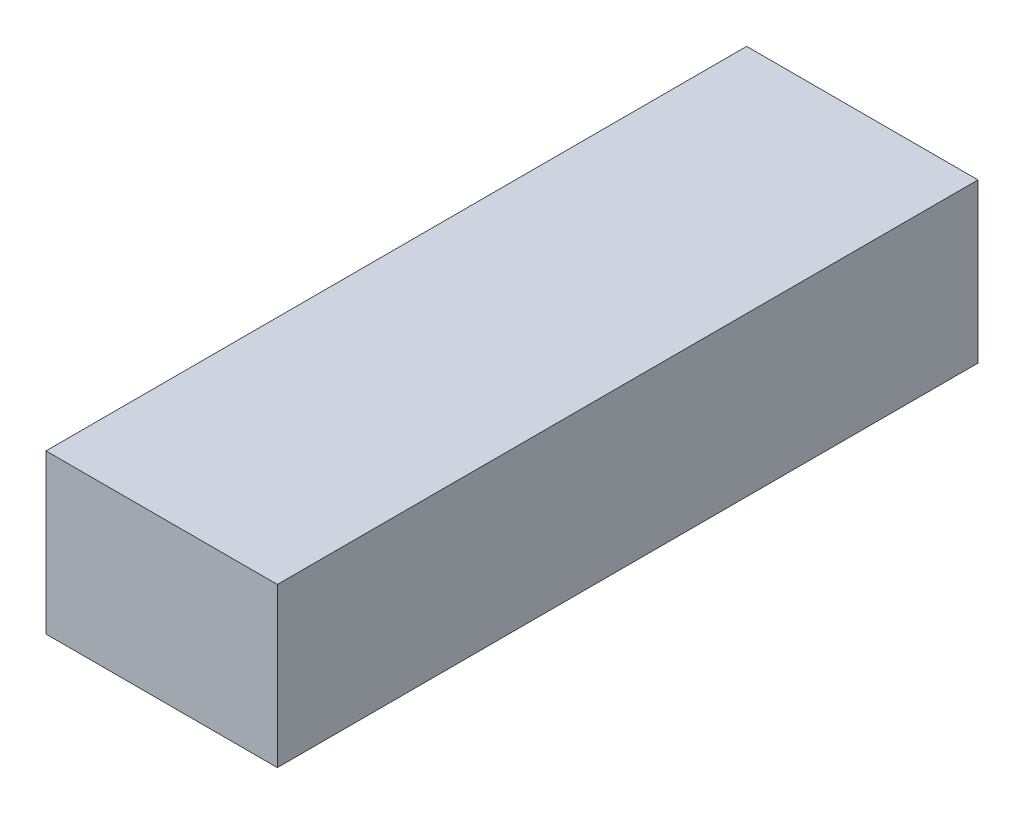
from build123d import *

# Parameters (mm, degrees)
SKETCH1_W           = 35
SKETCH1_H           = 24
BOSS_EXTRUDE1_DEPTH = 106


with BuildPart() as part:
    # Sketch1 → Boss-Extrude1 (new body)
    with BuildSketch(Plane.XY):
        Rectangle(SKETCH1_W, SKETCH1_H)
    extrude(amount=BOSS_EXTRUDE1_DEPTH)


solid = part.part
